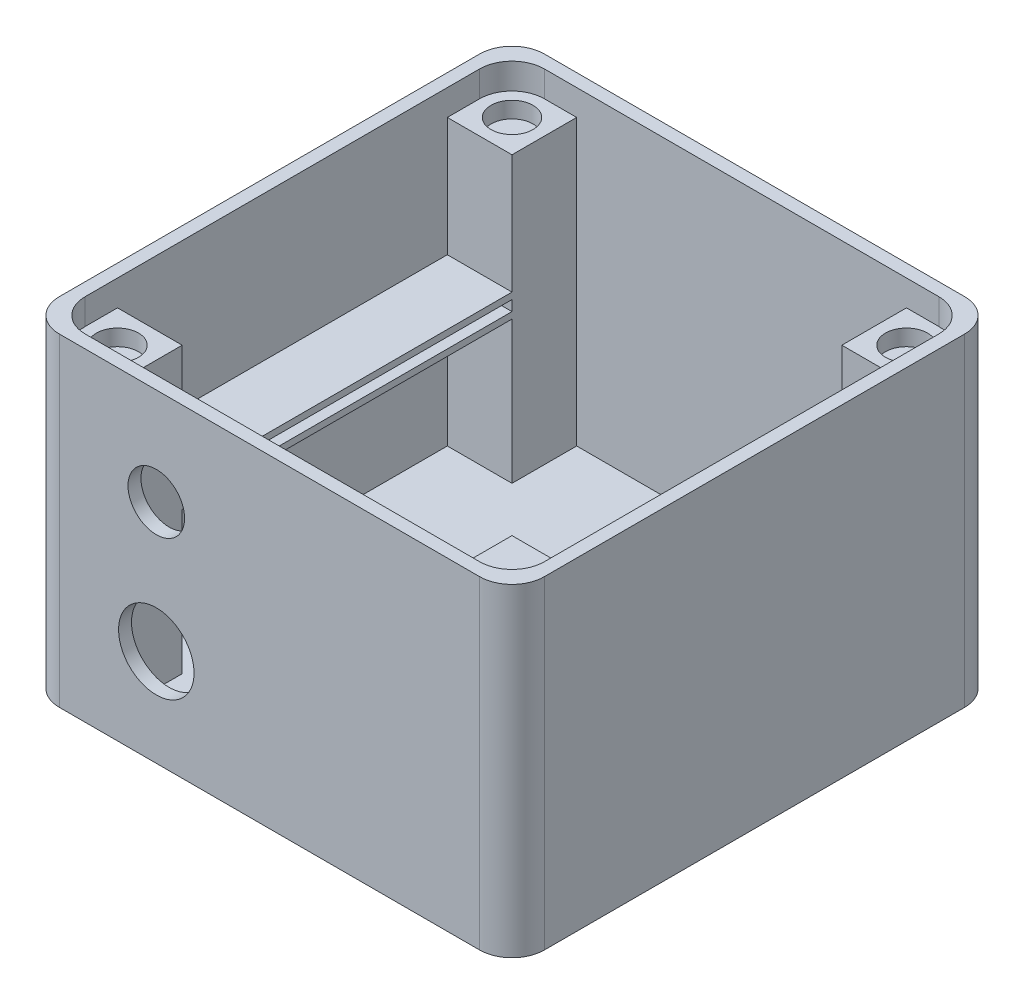
from build123d import *

# Parameters (mm, degrees)
SKETCH1_W           = 75
SKETCH1_H           = 75
BOSS_EXTRUDE1_DEPTH = 50
SKETCH2_W           = 71
SKETCH2_H           = 71
CUT_EXTRUDE1_DEPTH  = 48
CUT_EXTRUDE6_DEPTH  = 2
FILLET4_R           = 5
FILLET5_R           = 5
FILLET6_R           = 5
FILLET7_R           = 5
SKETCH4_W           = 10
SKETCH4_H           = 10
BOSS_EXTRUDE2_DEPTH = 44
SKETCH5_W           = 10
SKETCH5_H           = 10
BOSS_EXTRUDE3_DEPTH = 44
SKETCH8_W           = 51
SKETCH8_H           = 1
BOSS_EXTRUDE4_DEPTH = 10
SKETCH9_W           = 51
SKETCH9_H           = 1
BOSS_EXTRUDE5_DEPTH = 10
SKETCH11_R          = 3.25
CUT_EXTRUDE8_DEPTH  = 2.5
SKETCH12_R          = 4.375
CUT_EXTRUDE9_DEPTH  = 2
SKETCH13_R          = 5.838
CUT_EXTRUDE10_DEPTH = 2


with BuildPart() as part:
    # Sketch1 → Boss-Extrude1 (new body)
    with BuildSketch(Plane(origin=(0, 0, 0), x_dir=(1, 0, 0), z_dir=(0, 1, 0))):
        Rectangle(SKETCH1_W, SKETCH1_H)
    extrude(amount=BOSS_EXTRUDE1_DEPTH)

    # Sketch2 → Cut-Extrude1 (cut)
    with BuildSketch(Plane(origin=(0, 50, 0), x_dir=(1, 0, 0), z_dir=(0, 1, 0))):
        Rectangle(SKETCH2_W, SKETCH2_H)
    extrude(amount=-CUT_EXTRUDE1_DEPTH, mode=Mode.SUBTRACT)

    # Sketch3 → Cut-Extrude6 (cut)
    with BuildSketch(Plane.XZ):
        with BuildLine():
            add(Edge.make_bspline(
                [(8.333333333, 0), (8.451740367, 0.002755681), (8.687804992, 0.024362572), (9.156850661, 0.091751534), (10.280456566, 0.34563371), (11.894311549, 0.927153054), (13.898826649, 2.013834871), (16.012913856, 3.730779379), (17.760775609, 5.821518912), (19.049737677, 8.225078468), (19.814659338, 10.889902937), (19.985573746, 13.70225433), (19.539290317, 16.528302053), (18.494901563, 19.237024306), (16.925532574, 21.678165695), (14.89875072, 23.755747946), (12.484340707, 25.370708371), (9.802384445, 26.405476858), (6.98608034, 26.794959186), (4.109785684, 26.53719328), (0.722828385, 25.487699584), (-2.940307765, 23.340193971), (-6.647366, 20.112650151), (-10.3710479, 16.053559605), (-13.910491439, 11.839455496), (-17.496638537, 7.662725627), (-20.98187941, 4.115658379), (-23.987384387, 1.758333025), (-26.330229801, 0.518546697), (-27.55448652, 0.125207567), (-28.000518844, 0.031619583), (-28.254918245, 0.003498461), (-28.299650799, 0.000763354), (-28.322057313, 2.7753e-05), (-28.333267806, 1.08e-07)],
                knots=[0, 0, 0, 0, 0, 0.005562941, 0.011125882, 0.022251763, 0.05405154, 0.085851775, 0.117651832, 0.149451632, 0.181251419, 0.213051359, 0.246907992, 0.280764683, 0.314621503, 0.348478291, 0.382335072, 0.416191783, 0.450048462, 0.482370896, 0.514693479, 0.550840193, 0.615485432, 0.680130557, 0.744775838, 0.809420945, 0.874066354, 0.938711777, 0.978091789, 0.987992515, 0.997893241, 0.998946621, 0.99947331, 1, 1, 1, 1, 1], degree=4))
            add(Edge.make_bspline(
                [(8.333333333, 0), (8.451740367, -0.002755681), (8.687804992, -0.024362572), (9.156850661, -0.091751534), (10.280456566, -0.34563371), (11.894311549, -0.927153054), (13.898826649, -2.013834871), (16.012913856, -3.730779379), (17.760775609, -5.821518912), (19.049737677, -8.225078468), (19.814659338, -10.889902937), (19.985573746, -13.70225433), (19.539290317, -16.528302053), (18.494901563, -19.237024306), (16.925532574, -21.678165695), (14.89875072, -23.755747946), (12.484340707, -25.370708371), (9.802384445, -26.405476858), (6.98608034, -26.794959186), (4.109785684, -26.53719328), (0.722828385, -25.487699584), (-2.940307765, -23.340193971), (-6.647366, -20.112650151), (-10.3710479, -16.053559605), (-13.910491439, -11.839455496), (-17.496638537, -7.662725627), (-20.98187941, -4.115658379), (-23.987384387, -1.758333025), (-26.330229801, -0.518546697), (-27.55448652, -0.125207567), (-28.000518844, -0.031619583), (-28.254918245, -0.003498461), (-28.299650799, -0.000763354), (-28.322057313, -2.7753e-05), (-28.333267806, 1.08e-07)],
                knots=[0, 0, 0, 0, 0, 0.005562941, 0.011125882, 0.022251763, 0.05405154, 0.085851775, 0.117651832, 0.149451632, 0.181251419, 0.213051359, 0.246907992, 0.280764683, 0.314621503, 0.348478291, 0.382335072, 0.416191783, 0.450048462, 0.482370896, 0.514693479, 0.550840193, 0.615485432, 0.680130557, 0.744775838, 0.809420945, 0.874066354, 0.938711777, 0.978091789, 0.987992515, 0.997893241, 0.998946621, 0.99947331, 1, 1, 1, 1, 1], degree=4))
        make_face()
    extrude(amount=-CUT_EXTRUDE6_DEPTH, mode=Mode.SUBTRACT)

    # Fillet4
    fillet4_edges = [part.edges().sort_by_distance(p)[0] for p in [
        (35.5, 26, 35.5),
        (37.5, 25, 37.5),
    ]]
    fillet(fillet4_edges, radius=FILLET4_R)

    # Fillet5
    fillet5_edges = [part.edges().sort_by_distance(p)[0] for p in [
        (-35.5, 26, 35.5),
        (-37.5, 25, 37.5),
    ]]
    fillet(fillet5_edges, radius=FILLET5_R)

    # Fillet6
    fillet6_edges = [part.edges().sort_by_distance(p)[0] for p in [
        (-35.5, 26, -35.5),
        (-37.5, 25, -37.5),
    ]]
    fillet(fillet6_edges, radius=FILLET6_R)

    # Fillet7
    fillet7_edges = [part.edges().sort_by_distance(p)[0] for p in [
        (35.5, 26, -35.5),
        (37.5, 25, -37.5),
    ]]
    fillet(fillet7_edges, radius=FILLET7_R)

    # Sketch4 → Boss-Extrude2 (add)
    with BuildSketch(Plane(origin=(0, 2, 0), x_dir=(1, 0, 0), z_dir=(0, 1, 0))):
        with Locations((30.5, 30.5)):
            Rectangle(SKETCH4_W, SKETCH4_H)
    extrude(amount=BOSS_EXTRUDE2_DEPTH)

    # Sketch5 → Boss-Extrude3 (add)
    with BuildSketch(Plane(origin=(0, 2, 0), x_dir=(1, 0, 0), z_dir=(0, 1, 0))):
        with Locations((-30.5, 30.5)):
            Rectangle(SKETCH5_W, SKETCH5_H)
        with Locations((-30.5, -30.5)):
            Rectangle(SKETCH5_W, SKETCH5_H)
        with Locations((30.5, -30.5)):
            Rectangle(SKETCH5_W, SKETCH5_H)
    extrude(amount=BOSS_EXTRUDE3_DEPTH)

    # Sketch8 → Boss-Extrude4 (add)
    with BuildSketch(Plane(origin=(-35.5, 0, 0), x_dir=(0, 0, -1), z_dir=(1, 0, 0))):
        with Locations((0, 24.5)):
            Rectangle(SKETCH8_W, SKETCH8_H)
    extrude(amount=BOSS_EXTRUDE4_DEPTH)

    # Sketch9 → Boss-Extrude5 (add)
    with BuildSketch(Plane(origin=(-35.5, 0, 0), x_dir=(0, 0, -1), z_dir=(1, 0, 0))):
        with Locations((0, 27.11)):
            Rectangle(SKETCH9_W, SKETCH9_H)
    extrude(amount=BOSS_EXTRUDE5_DEPTH)

    # Sketch11 → Cut-Extrude8 (cut)
    with BuildSketch(Plane(origin=(0, 46, 0), x_dir=(1, 0, 0), z_dir=(0, 1, 0))):
        with Locations(Location((30.5, 30.5, 0), (0, 0, 270))):
            Circle(SKETCH11_R)
        with Locations(Location((-30.5, 30.5, 0), (0, 0, 270))):
            Circle(SKETCH11_R)
        with Locations(Location((-30.5, -30.5, 0), (0, 0, 270))):
            Circle(SKETCH11_R)
    extrude(amount=-CUT_EXTRUDE8_DEPTH, mode=Mode.SUBTRACT)

    # Sketch12 → Cut-Extrude9 (cut)
    with BuildSketch(Plane(origin=(0, 0, 35.5), x_dir=(-1, 0, 0), z_dir=(0, 0, -1))):
        with Locations((17.5, 35)):
            Circle(SKETCH12_R)
    extrude(amount=-CUT_EXTRUDE9_DEPTH, mode=Mode.SUBTRACT)

    # Sketch13 → Cut-Extrude10 (cut)
    with BuildSketch(Plane(origin=(0, 0, 35.5), x_dir=(-1, 0, 0), z_dir=(0, 0, -1))):
        with Locations((17.5, 15)):
            Circle(SKETCH13_R)
    extrude(amount=-CUT_EXTRUDE10_DEPTH, mode=Mode.SUBTRACT)


solid = part.part
